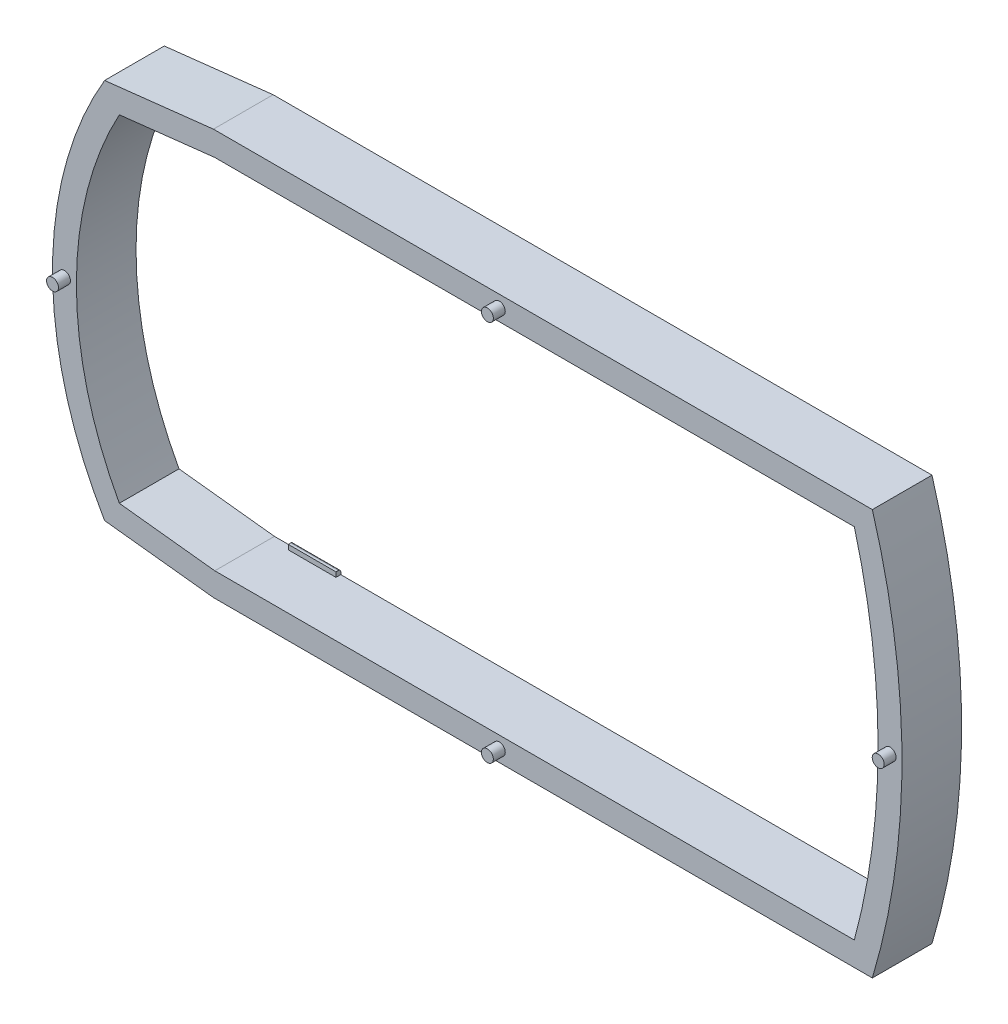
from build123d import *

# Parameters (mm, degrees)
EXTRU_MINCE1_DEPTH = 25
ESQUISSE1_13_W     = 3
ESQUISSE1_13_H     = 25
BOSS_EXTRU_1_DEPTH = 2
ESQUISSE1_14_W     = 20
ESQUISSE1_14_H     = 2
BOSS_EXTRU_2_DEPTH = 2
ESQUISSE1_15_W     = 20
ESQUISSE1_15_H     = 2
BOSS_EXTRU_3_DEPTH = 2
CONG_2_R           = 1
CONG_3_R           = 1
CONG_4_R           = 0.5
ESQUISSE1_18_R     = 2.5
BOSS_EXTRU_5_DEPTH = 30
ESQUISSE1_19_R     = 2.5
BOSS_EXTRU_6_DEPTH = 30
ESQUISSE1_20_R     = 2.5
BOSS_EXTRU_7_DEPTH = 30
ESQUISSE1_21_R     = 2.5
BOSS_EXTRU_8_DEPTH = 30


with BuildPart() as part:
    # Esquisse1 → Extru.-Mince1 (new body)
    with BuildSketch(Plane.XY):
        with BuildLine():
            Line((-198.953146912, 52.713133275), (-153.336718001, 57.844981528))
            Line((-153.336718001, 57.844981528), (122.776592962, 57.844981528))
            ThreePointArc((122.776592962, 57.844981528), (135.183889941, -27.155018472), (122.776592962, -112.155018472))
            Line((122.776592962, -112.155018472), (-153.336718001, -112.155018472))
            Line((-153.336718001, -112.155018472), (-198.953146912, -107.02317022))
            ThreePointArc((-198.953146912, -107.02317022), (-220.774609776, -27.155018472), (-198.953146912, 52.713133275))
        make_face()
        with BuildLine():
            Line((-192.775986612, 43.344981528), (-152.775986612, 47.844981528))
            Line((-152.775986612, 47.844981528), (115.224013388, 47.844981528))
            ThreePointArc((115.224013388, 47.844981528), (125.183889941, -27.155018472), (115.224013388, -102.155018472))
            Line((115.224013388, -102.155018472), (-152.775986612, -102.155018472))
            Line((-152.775986612, -102.155018472), (-192.775986612, -97.655018472))
            ThreePointArc((-192.775986612, -97.655018472), (-210.774609776, -27.155018472), (-192.775986612, 43.344981528))
        make_face(mode=Mode.SUBTRACT)
    extrude(amount=EXTRU_MINCE1_DEPTH)

    # Esquisse1<14> → Boss.-Extru.2 (add)
    with BuildSketch(Plane.XY):
        with Locations((-134.987389646, -101.155018472)):
            Rectangle(ESQUISSE1_14_W, ESQUISSE1_14_H)
    extrude(amount=BOSS_EXTRU_2_DEPTH)

    # Esquisse1<15> → Boss.-Extru.3 (add)
    with BuildSketch(Plane.XY):
        with Locations((-134.987389646, 46.844981528)):
            Rectangle(ESQUISSE1_15_W, ESQUISSE1_15_H)
    extrude(amount=BOSS_EXTRU_3_DEPTH)

    # Congé2
    cong_2_edges = [part.edges().sort_by_distance(p)[0] for p in [
        (-134.987389646, 45.844981528, 0),
    ]]
    fillet(cong_2_edges, radius=CONG_2_R)

    # Congé3
    cong_3_edges = [part.edges().sort_by_distance(p)[0] for p in [
        (-134.987389646, -100.155018472, 0),
    ]]
    fillet(cong_3_edges, radius=CONG_3_R)

    # Esquisse1<18> → Boss.-Extru.5 (add)
    with BuildSketch(Plane.XY):
        with Locations((-33.549027095, -107.155018472)):
            Circle(ESQUISSE1_18_R)
    extrude(amount=BOSS_EXTRU_5_DEPTH)

    # Esquisse1<19> → Boss.-Extru.6 (add)
    with BuildSketch(Plane.XY):
        with Locations((-33.549027095, 52.844981528)):
            Circle(ESQUISSE1_19_R)
    extrude(amount=BOSS_EXTRU_6_DEPTH)

    # Esquisse1<20> → Boss.-Extru.7 (add)
    with BuildSketch(Plane.XY):
        with Locations((130.224013388, -27.155018472)):
            Circle(ESQUISSE1_20_R)
    extrude(amount=BOSS_EXTRU_7_DEPTH)

    # Esquisse1<21> → Boss.-Extru.8 (add)
    with BuildSketch(Plane.XY):
        with Locations((-215.775986612, -27.155018472)):
            Circle(ESQUISSE1_21_R)
    extrude(amount=BOSS_EXTRU_8_DEPTH)


with BuildPart() as body_2:
    # Esquisse1<13> → Boss.-Extru.1 (new body)
    with BuildSketch(Plane.XY):
        with Locations((123.411892491, -27.155018472)):
            Rectangle(ESQUISSE1_13_W, ESQUISSE1_13_H)
    extrude(amount=BOSS_EXTRU_1_DEPTH)

    # Congé4
    cong_4_edges = [body_2.edges().sort_by_distance(p)[0] for p in [
        (121.911892491, -27.155018472, 0),
    ]]
    fillet(cong_4_edges, radius=CONG_4_R)


solid = Compound([part.part, body_2.part])
